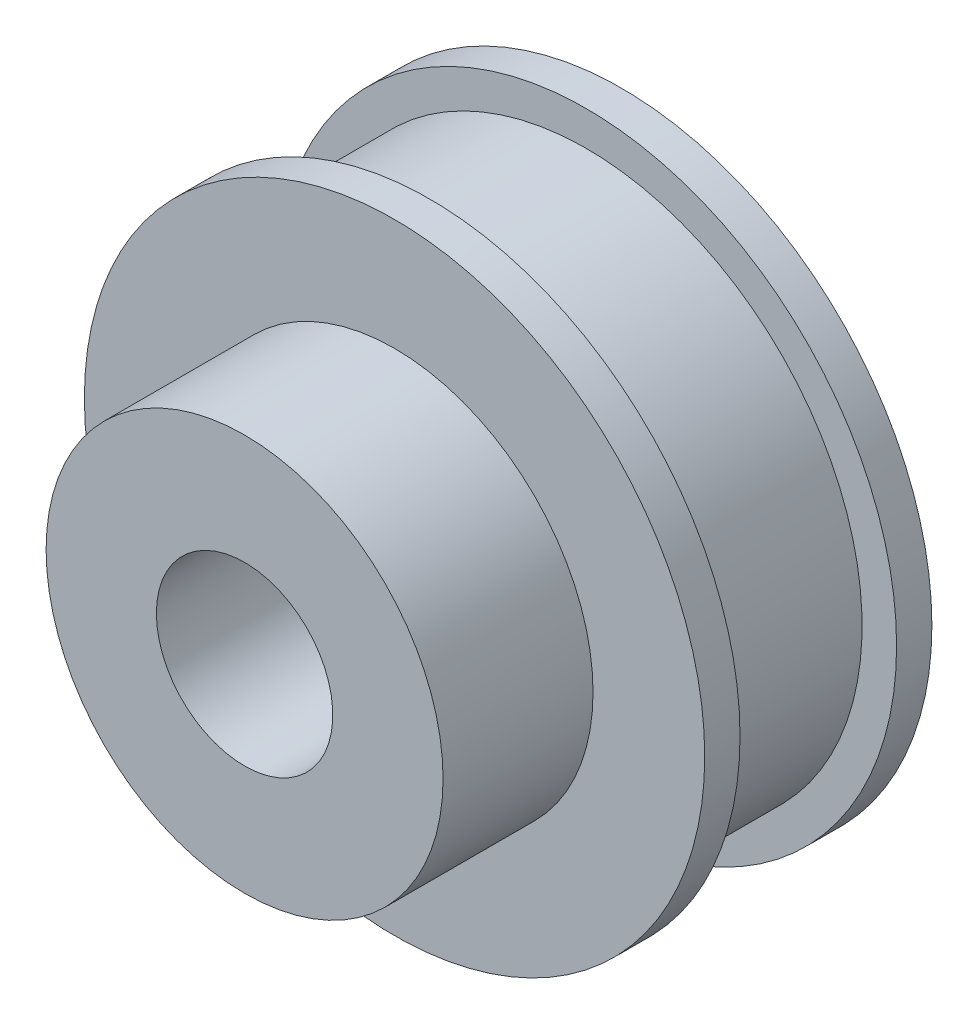
from build123d import *


with BuildPart() as part:
    # Sketch1 → Revolve1 (revolve)
    with BuildSketch(Plane(origin=(0, 0, 0), x_dir=(-1, 0, 0), z_dir=(0, 1, 0)), mode=Mode.PRIVATE) as revolve1_sk:
        Polygon((-14.065, 0.8), (-14.065, -0.8), (-4, -0.8), (-4, 16.3), (-9, 16.3), (-9, 9.5), (-14.065, 9.5), (-14.065, 7.9), (-12.5, 7.9), (-12.5, 0.8), align=None)
    revolve(revolve1_sk.sketch.rotate(Axis((0, 0, 0), (0, 0, 1)), 180), axis=Axis((0, 0, 0), (0, 0, 1)))


solid = part.part
